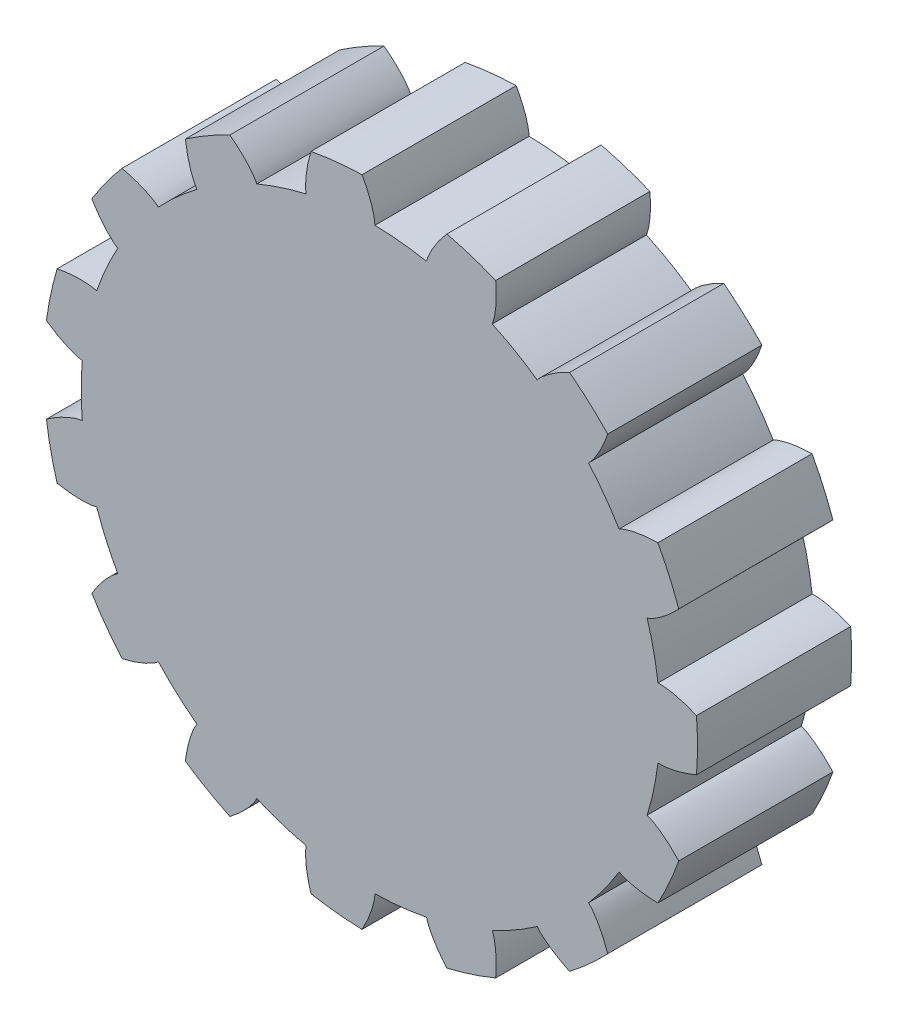
from build123d import *

# Parameters (mm, degrees)
SKETCH6_R           = 47.688639705
BOSS_EXTRUDE3_DEPTH = 25.4
BOSS_EXTRUDE4_DEPTH = 25.4
CIRPATTERN1_COUNT   = 15


with BuildPart() as part:
    # Sketch6 → Boss-Extrude3 (new body)
    with BuildSketch(Plane.XY):
        Circle(SKETCH6_R)
    extrude(amount=BOSS_EXTRUDE3_DEPTH)

    # Sketch5 → Boss-Extrude4 (add)
    with BuildSketch(Plane.XY):
        with BuildLine():
            ThreePointArc((-1.408071238, 53.84520723), (-5.630280888, 53.568544346), (-9.817746575, 52.961314735))
            add(Edge.make_bspline(
                [(-10.610061638, 46.493364569), (-10.709772142, 47.029021497), (-10.734707714, 48.102849794), (-10.568826593, 49.872777698), (-10.241208192, 51.488329618), (-9.939095864, 52.566483824), (-9.817746575, 52.961314735)],
                knots=[0, 0, 0, 0, 0.145749794, 0.286840016, 0.476245084, 0.587002811, 0.587002811, 0.587002811, 0.587002811], degree=3))
            ThreePointArc((-10.610061638, 46.493364569), (-4.984820224, 47.427396347), (0.711692296, 47.683328858))
            add(Edge.make_bspline(
                [(0.711692296, 47.683328858), (0.697854548, 48.228011376), (0.498983761, 49.283558346), (-0.031261162, 50.980320455), (-0.687612447, 52.492452993), (-1.207283759, 53.484234257), (-1.408071238, 53.84520723)],
                knots=[0, 0, 0, 0, 0.145749794, 0.286840016, 0.476245084, 0.587002811, 0.587002811, 0.587002811, 0.587002811], degree=3))
        make_face()
    boss_extrude4 = extrude(amount=BOSS_EXTRUDE4_DEPTH)

    # CirPattern1: Boss-Extrude4 ×15 about axis
    cirpattern1_axis = Axis((0, 0, 25.4), (0, 0, 1))
    for i in range(1, CIRPATTERN1_COUNT):
        add(boss_extrude4.rotate(cirpattern1_axis, i * 360 / CIRPATTERN1_COUNT))


solid = part.part
